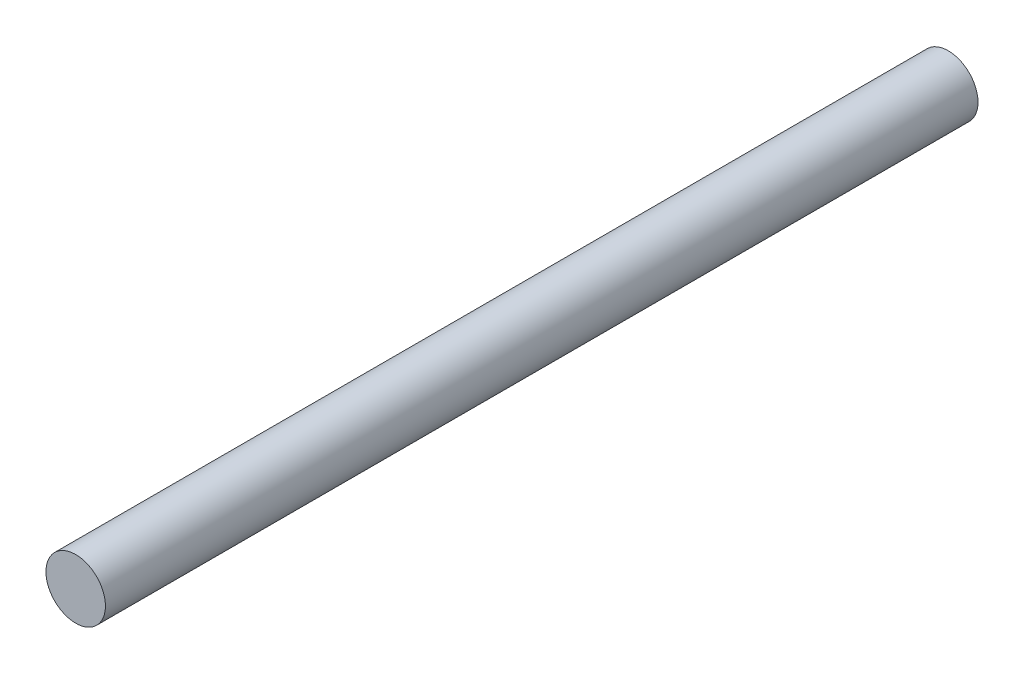
from build123d import *

# Parameters (mm, degrees)
SKETCH1_R        = 1.5
EXTRUSION1_DEPTH = 44


with BuildPart() as part:
    # Sketch1 → Extrusion1 (new body)
    with BuildSketch(Plane.XY):
        Circle(SKETCH1_R)
    extrude(amount=EXTRUSION1_DEPTH)


solid = part.part
